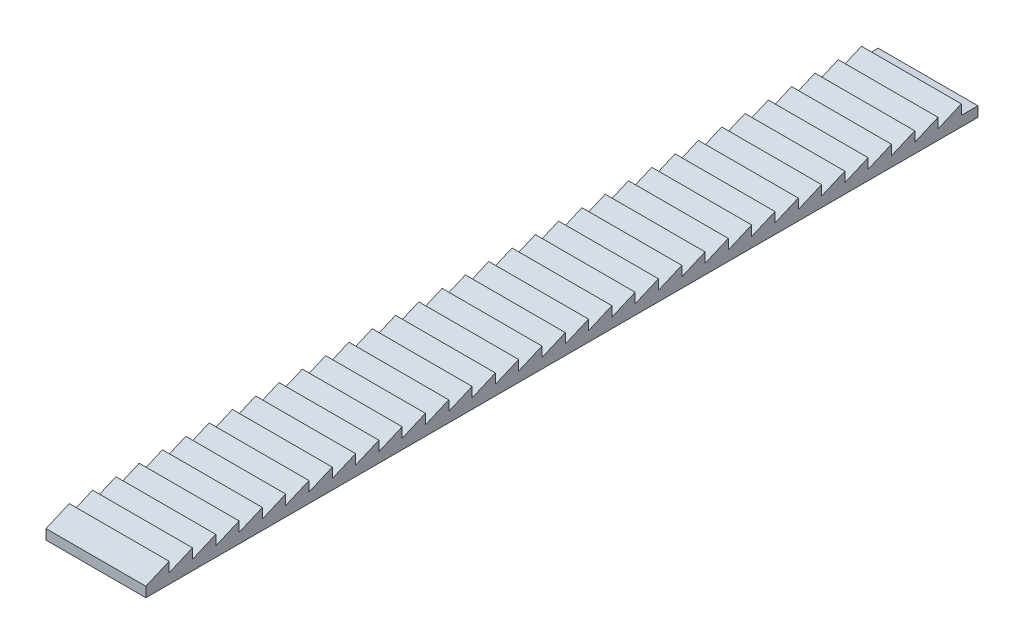
from build123d import *

# Parameters (mm, degrees)
SKETCH_1_W             = 30
SKETCH_1_H             = 250
EXTRUDE_1_DEPTH        = 3
EXTRUDE_2_DEPTH        = 15
PATTERN_LINEAR_1_COUNT = 35
PATTERN_LINEAR_1_PITCH = 7


with BuildPart() as part:
    # 스케치1 → 보스-돌출1 (new body)
    with BuildSketch(Plane(origin=(0, 0, 0), x_dir=(1, 0, 0), z_dir=(0, 1, 0))):
        Rectangle(SKETCH_1_W, SKETCH_1_H)
    extrude(amount=EXTRUDE_1_DEPTH)

    # 스케치3 → 보스-돌출2 (add, symmetric)
    with BuildSketch(Plane(origin=(0, 0, 0), x_dir=(0, 0, -1), z_dir=(1, 0, 0))):
        Polygon((-125, 3), (-118, 6), (-118, 3), align=None)
    extrude_2 = extrude(amount=EXTRUDE_2_DEPTH, both=True)

    # 선형 패턴1: 보스-돌출2 ×35
    with Locations(*[(0, 0, -i * PATTERN_LINEAR_1_PITCH) for i in range(1, PATTERN_LINEAR_1_COUNT)]):
        add(extrude_2)


solid = part.part
